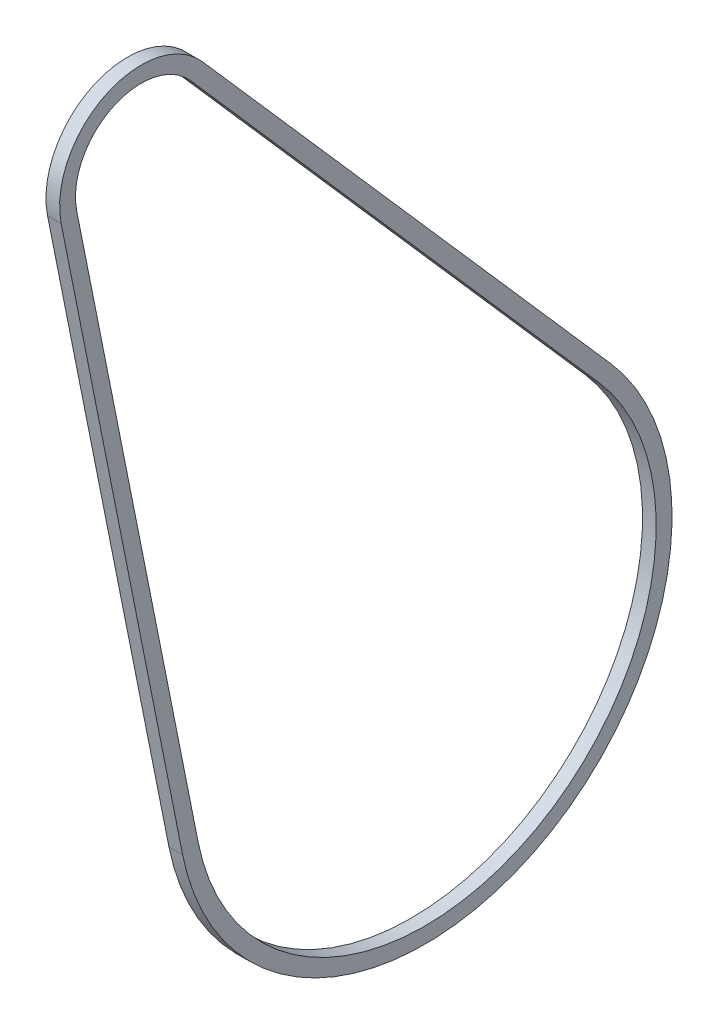
from build123d import *

# Parameters (mm, degrees)
BOSS_EXTRUDE1_DEPTH = 6.5


with BuildPart() as part:
    # Sketch1 → Boss-Extrude1 (new body)
    with BuildSketch(Plane(origin=(120.8182, 0, 0), x_dir=(0, 0, -1), z_dir=(1, 0, 0))):
        with BuildLine():
            Line((846.478661638, 494.561851817), (1040.702839036, 273.07651954))
            ThreePointArc((1040.702839036, 273.07651954), (1004.366479469, 90.186693697), (837.070444967, 172.533862824))
            Line((837.070444967, 172.533862824), (779.311502219, 461.398343217))
            ThreePointArc((779.311502219, 461.398343217), (800.164646921, 503.763471885), (846.478661638, 494.561851817))
        make_face()
        with BuildLine():
            Line((840.809621425, 489.590576019), (1035.033798823, 268.105243742))
            ThreePointArc((1035.033798823, 268.105243742), (1001.028357677, 96.947503035), (844.464091935, 174.012235074))
            Line((844.464091935, 174.012235074), (786.705149187, 462.876715467))
            ThreePointArc((786.705149187, 462.876715467), (803.502768714, 497.002662547), (840.809621425, 489.590576019))
        make_face(mode=Mode.SUBTRACT)
    extrude(amount=-BOSS_EXTRUDE1_DEPTH)


solid = part.part
